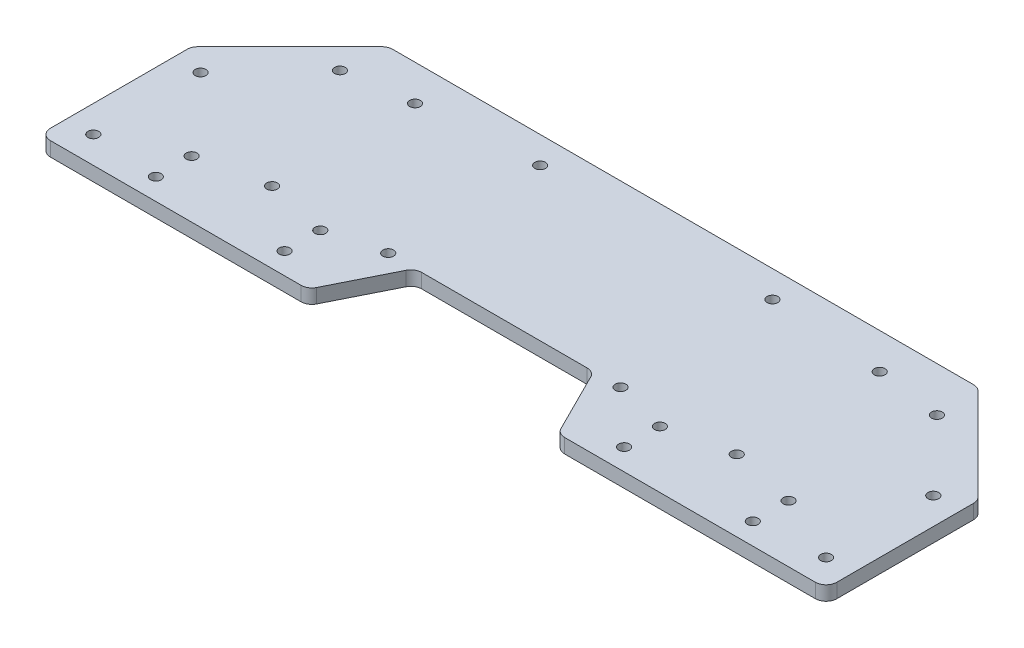
from build123d import *

# Parameters (mm, degrees)
EXTRUDE_1_DEPTH     = 4
SKETCH_2_R          = 1.5
CUT_EXTRUDE_1_DEPTH = 4
SKETCH_3_W          = 10
SKETCH_3_H          = 69.678883607
SKETCH_3_H_2        = 93.047687854
CUT_EXTRUDE_2_DEPTH = 4
CUT_EXTRUDE_3_DEPTH = 4
EXTRUDE_2_DEPTH     = 4
SKETCH_6_R          = 1.5
CUT_EXTRUDE_4_DEPTH = 10
FILLET_1_R          = 3
SKETCH_7_R          = 1.503168948
SKETCH_7_R_2        = 1.5
CUT_EXTRUDE_5_DEPTH = 10
SKETCH_8_R          = 1.5
CUT_EXTRUDE_6_DEPTH = 10


with BuildPart() as part:
    # 草图1 → 凸台-拉伸1 (new body)
    with BuildSketch(Plane(origin=(0, 0, 0), x_dir=(1, 0, 0), z_dir=(0, 1, 0))):
        Polygon((-137.5, -35), (-67.5, -35), (-57.5, -35), (-47.5, -15), (2.5, -15), (12.5, -35), (22.5, -35), (92.5, -35), (92.5, 15), (72.5, 35), (-117.5, 35), (-137.5, 15), align=None)
    extrude(amount=EXTRUDE_1_DEPTH)

    # 草图2 → 切除-拉伸1 (cut)
    with BuildSketch(Plane(origin=(0, 4, 0), x_dir=(1, 0, 0), z_dir=(0, 1, 0))):
        with Locations(Location((-87.5, -15, 0), (0, 0, 270))):
            Circle(SKETCH_2_R)
        with Locations(Location((-87.5, 25, 0), (0, 0, 270))):
            Circle(SKETCH_2_R)
        with Locations(Location((42.5, 25, 0), (0, 0, 90))):
            Circle(SKETCH_2_R)
        with Locations(Location((42.5, -15, 0), (0, 0, 90))):
            Circle(SKETCH_2_R)
    extrude(amount=-CUT_EXTRUDE_1_DEPTH, mode=Mode.SUBTRACT)

    # 草图3 → 切除-拉伸2 (cut)
    with BuildSketch(Plane(origin=(0, 4, 0), x_dir=(1, 0, 0), z_dir=(0, 1, 0))):
        with Locations((-132.5, -0.160558196)):
            Rectangle(SKETCH_3_W, SKETCH_3_H)
        with Locations((87.5, 11.523843927)):
            Rectangle(SKETCH_3_W, SKETCH_3_H_2)
    extrude(amount=-CUT_EXTRUDE_2_DEPTH, mode=Mode.SUBTRACT)

    # 草图4 → 切除-拉伸3 (cut)
    with BuildSketch(Plane(origin=(0, 4, 0), x_dir=(1, 0, 0), z_dir=(0, 1, 0))):
        Polygon((-127.5, 12.5), (-92.197077218, 47.802922782), (-150.178982695, 47.802922782), align=None)
        Polygon((82.5, 12.5), (37.005283765, 57.994716235), (96.544114713, 56.205234398), align=None)
    extrude(amount=-CUT_EXTRUDE_3_DEPTH, mode=Mode.SUBTRACT)

    # 草图5 → 凸台-拉伸2 (add)
    with BuildSketch(Plane(origin=(0, 4, 0), x_dir=(1, 0, 0), z_dir=(0, 1, 0))):
        Polygon((-127.5, 12.5), (-132.5, 7.5), (-132.5, -35), (-127.5, -35), align=None)
        Polygon((82.5, -35), (82.5, 12.5), (87.5, 7.5), (87.5, -35), align=None)
    extrude(amount=-EXTRUDE_2_DEPTH)

    # 草图6 → 切除-拉伸4 (cut)
    with BuildSketch(Plane(origin=(0, 4, 0), x_dir=(1, 0, 0), z_dir=(0, 1, 0))):
        with Locations(Location((61, -29, 0), (0, 0, 270))):
            Circle(SKETCH_6_R)
        with Locations(Location((61, -19, 0), (0, 0, 270))):
            Circle(SKETCH_6_R)
        with Locations(Location((25, -19, 0), (0, 0, 270))):
            Circle(SKETCH_6_R)
        with Locations(Location((25, -29, 0), (0, 0, 270))):
            Circle(SKETCH_6_R)
        with Locations(Location((-70, -29, 0), (0, 0, 90))):
            Circle(SKETCH_6_R)
        with Locations(Location((-70, -19, 0), (0, 0, 90))):
            Circle(SKETCH_6_R)
        with Locations(Location((-106, -19, 0), (0, 0, 90))):
            Circle(SKETCH_6_R)
        with Locations(Location((-106, -29, 0), (0, 0, 90))):
            Circle(SKETCH_6_R)
    extrude(amount=-CUT_EXTRUDE_4_DEPTH, mode=Mode.SUBTRACT)

    # 圆角1
    fillet_1_edges = [part.edges().sort_by_distance(p)[0] for p in [
        (60, 2, -35),
        (-132.5, 2, -7.5),
        (-132.5, 2, 35),
        (87.5, 2, -7.5),
        (87.5, 2, 35),
        (12.5, 2, 35),
        (2.5, 2, 15),
        (-47.5, 2, 15),
        (-57.5, 2, 35),
        (-105, 2, -35),
    ]]
    fillet(fillet_1_edges, radius=FILLET_1_R)

    # 草图7 → 切除-拉伸5 (cut)
    with BuildSketch(Plane(origin=(0, 4, 0), x_dir=(1, 0, 0), z_dir=(0, 1, 0))):
        with Locations(Location((80, -27.5, 0), (0, 0, 270))):
            Circle(SKETCH_7_R)
        with Locations(Location((80, 2.5, 0), (0, 0, 270))):
            Circle(SKETCH_7_R)
        with Locations(Location((-125, 2.5, 0), (0, 0, 90))):
            Circle(SKETCH_7_R)
        with Locations(Location((-125, -27.5, 0), (0, 0, 90))):
            Circle(SKETCH_7_R)
        with Locations(Location((10, -15, 0), (0, 0, 270))):
            Circle(SKETCH_7_R_2)
        with Locations(Location((10, 27.5, 0), (0, 0, 270))):
            Circle(SKETCH_7_R_2)
        with Locations(Location((-55, 27.5, 0), (0, 0, 90))):
            Circle(SKETCH_7_R_2)
        with Locations(Location((-55, -15, 0), (0, 0, 90))):
            Circle(SKETCH_7_R_2)
    extrude(amount=-CUT_EXTRUDE_5_DEPTH, mode=Mode.SUBTRACT)

    # 草图8 → 切除-拉伸6 (cut)
    with BuildSketch(Plane(origin=(0, 4, 0), x_dir=(1, 0, 0), z_dir=(0, 1, 0))):
        with Locations(Location((61, 22.5, 0), (0, 0, 270))):
            Circle(SKETCH_8_R)
        with Locations(Location((-106, 22.5, 0), (0, 0, 90))):
            Circle(SKETCH_8_R)
    extrude(amount=-CUT_EXTRUDE_6_DEPTH, mode=Mode.SUBTRACT)


solid = part.part
